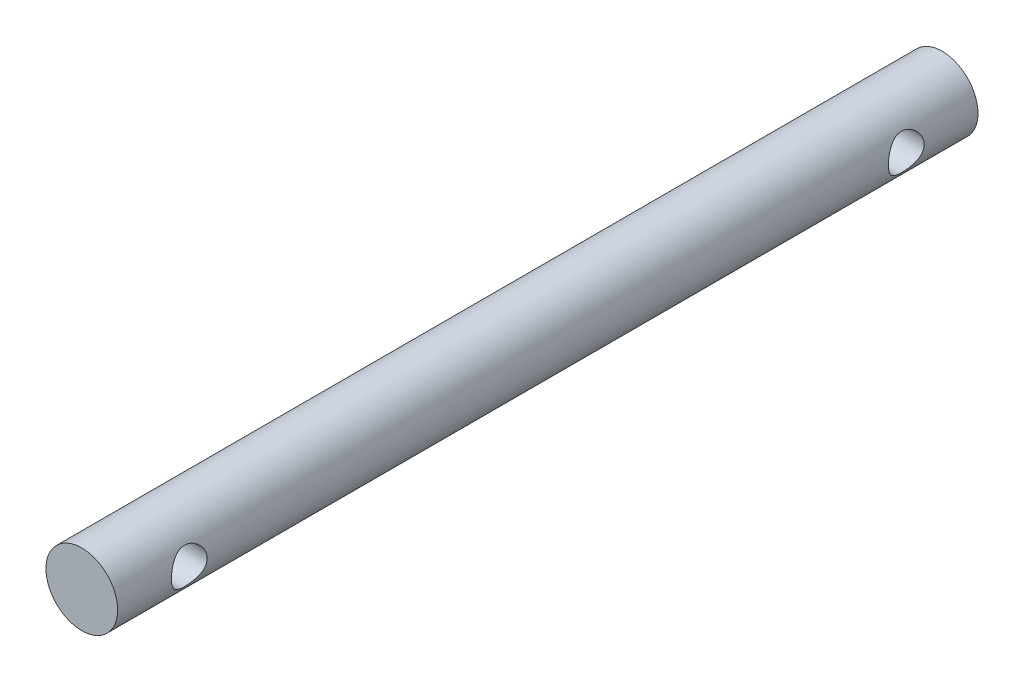
from build123d import *

# Parameters (mm, degrees)
ESQUISSE1_R             = 2.5
BOSS_EXTRU_1_DEPTH      = 60
CUT_EXTRUDE1_DEPTH      = 10
CUT_EXTRUDE1_DEPTH_BACK = 10
SKETCH1_R               = 1.25


with BuildPart() as part:
    # Esquisse1 → Boss.-Extru.1 (new body)
    with BuildSketch(Plane.XY):
        Circle(ESQUISSE1_R)
    extrude(amount=BOSS_EXTRU_1_DEPTH)

    # Sketch1 → Cut-Extrude1 (cut, two sides: drawn at the far end of the back side and taken through both)
    with BuildSketch(Plane(origin=(0, 0, 0), x_dir=(0, 0, -1), z_dir=(1, 0, 0)).offset(-CUT_EXTRUDE1_DEPTH_BACK)):
        with Locations((-55, 0)):
            Circle(SKETCH1_R)
        with Locations((-5, 0)):
            Circle(SKETCH1_R)
    extrude(amount=CUT_EXTRUDE1_DEPTH + CUT_EXTRUDE1_DEPTH_BACK, mode=Mode.SUBTRACT)


solid = part.part
